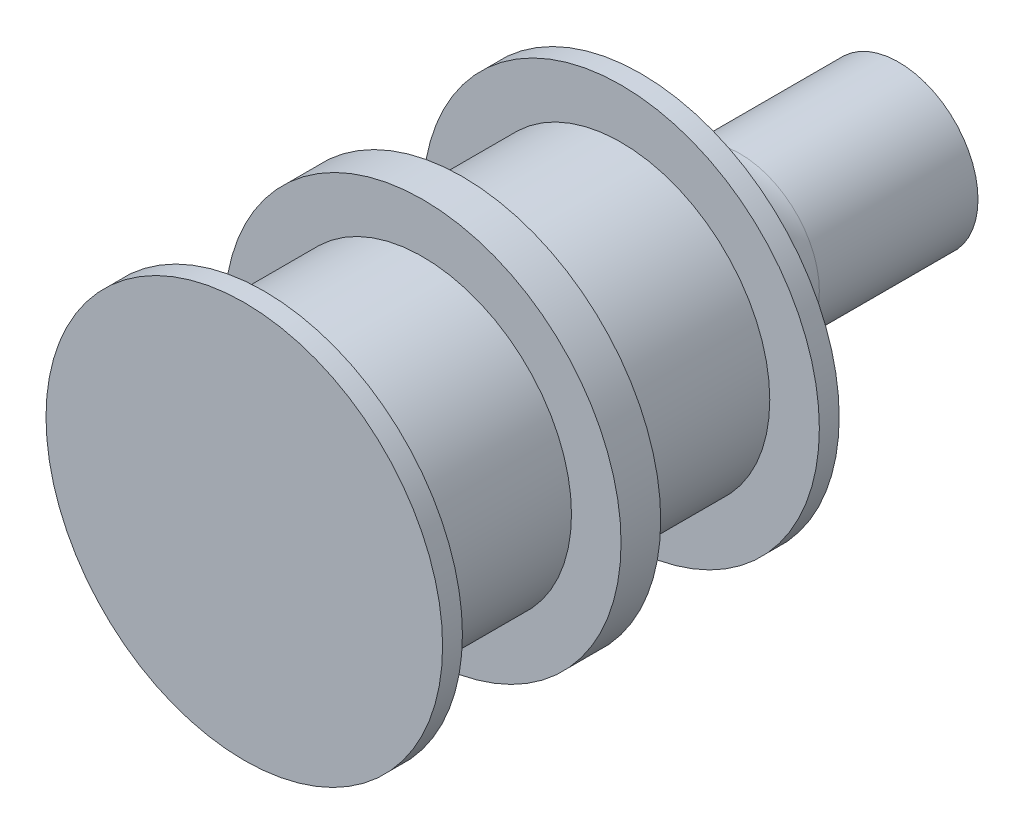
from build123d import *

# Parameters (mm, degrees)
CROQUIS1_R              = 10
SALIENTE_EXTRUIR1_DEPTH = 5
CROQUIS2_R              = 10
CROQUIS2_R_2            = 7.5
CORTAR_EXTRUIR1_DEPTH   = 4
CROQUIS3_R              = 4
SALIENTE_EXTRUIR2_DEPTH = 13
CROQUIS4_R              = 2.5
CORTAR_EXTRUIR2_DEPTH   = 8
REDONDEO1_R             = 5


with BuildPart() as part:
    # Croquis1 → Saliente-Extruir1 (new, symmetric)
    with BuildSketch(Plane(origin=(0, 0, 0), x_dir=(0, 1, 0), z_dir=(0, 0, 1))):
        with Locations(Location((0, 0, 0), (0, 0, 270))):
            Circle(CROQUIS1_R)
    extrude(amount=SALIENTE_EXTRUIR1_DEPTH, both=True)

    # Croquis2 → Cortar-Extruir1 (cut, symmetric)
    with BuildSketch(Plane(origin=(0, 0, 0), x_dir=(0, 1, 0), z_dir=(0, 0, 1))):
        with Locations(Location((0, 0, 0), (0, 0, 270))):
            Circle(CROQUIS2_R)
        with Locations(Location((0, 0, 0), (0, 0, 270))):
            Circle(CROQUIS2_R_2, mode=Mode.SUBTRACT)
    extrude(amount=CORTAR_EXTRUIR1_DEPTH, both=True, mode=Mode.SUBTRACT)

    # Simetría2: part across plane


with BuildPart() as part_1:
    add(part.part)
    add(part.part.mirror(Plane.XY.offset(5)))

    # Croquis3 → Saliente-Extruir2 (add)
    with BuildSketch(Plane(origin=(0, 0, -5), x_dir=(-1, 0, 0), z_dir=(0, 0, -1))):
        with Locations(Location((0, 0, 0), (0, 0, 180))):
            Circle(CROQUIS3_R)
    extrude(amount=SALIENTE_EXTRUIR2_DEPTH)

    # Croquis4 → Cortar-Extruir2 (cut)
    with BuildSketch(Plane(origin=(0, 0, -18), x_dir=(-1, 0, 0), z_dir=(0, 0, -1))):
        Circle(CROQUIS4_R)
    extrude(amount=-CORTAR_EXTRUIR2_DEPTH, mode=Mode.SUBTRACT)

    # Redondeo1
    redondeo1_edges = [part_1.edges().sort_by_distance(p)[0] for p in [
        (-4, 0, -5),
    ]]
    fillet(redondeo1_edges, radius=REDONDEO1_R)


solid = part_1.part
